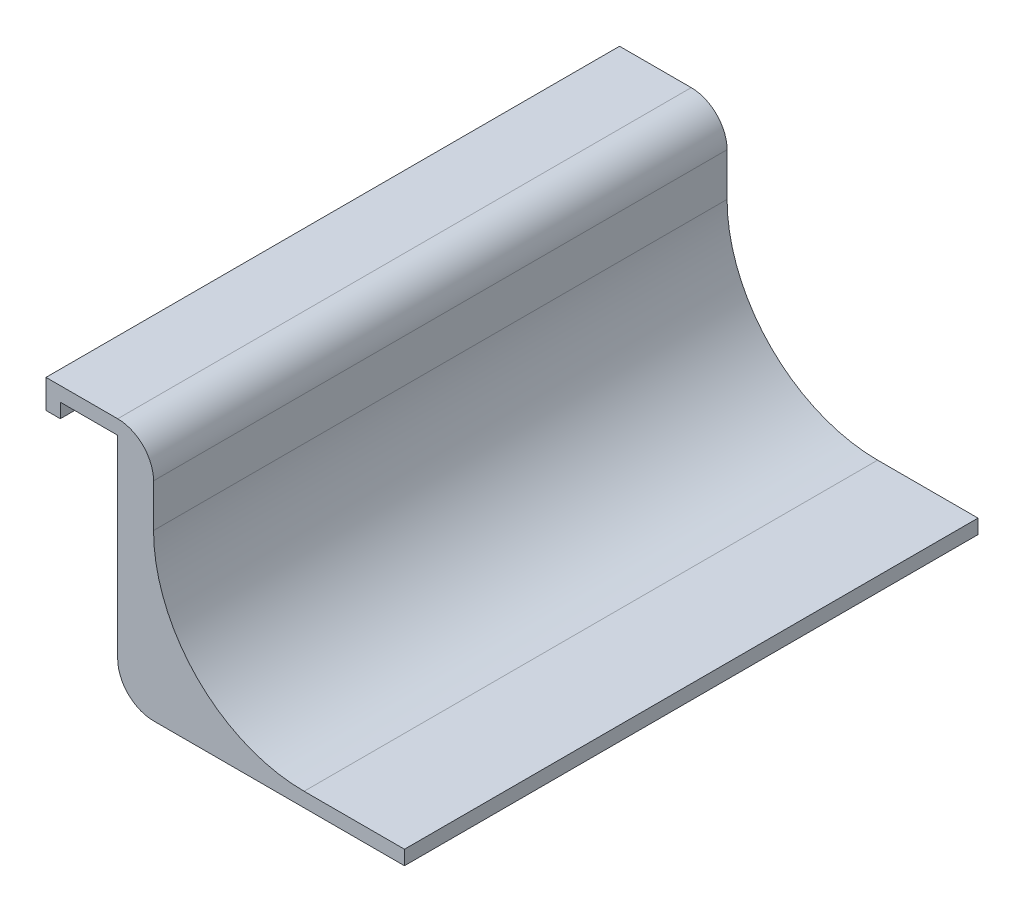
from build123d import *

# Parameters (mm, degrees)
SKETCH1_W           = 40
SKETCH1_H           = 80
BOSS_EXTRUDE4_DEPTH = 2
SKETCH4_W           = 5
SKETCH4_H           = 80
BOSS_EXTRUDE5_DEPTH = 32
FILLET3_R           = 21
SKETCH5_W           = 80
SKETCH5_H           = 2
BOSS_EXTRUDE6_DEPTH = 10
SKETCH6_W           = 2
SKETCH6_H           = 80
BOSS_EXTRUDE7_DEPTH = 2
FILLET4_R           = 5


with BuildPart() as part:
    # Sketch1 → Boss-Extrude4 (new body)
    with BuildSketch(Plane(origin=(0, 0, 0), x_dir=(1, 0, 0), z_dir=(0, 1, 0))):
        Rectangle(SKETCH1_W, SKETCH1_H)
    extrude(amount=BOSS_EXTRUDE4_DEPTH)

    # Sketch4 → Boss-Extrude5 (add)
    with BuildSketch(Plane(origin=(0, 2, 0), x_dir=(1, 0, 0), z_dir=(0, 1, 0))):
        with Locations((-17.5, 0)):
            Rectangle(SKETCH4_W, SKETCH4_H)
    extrude(amount=BOSS_EXTRUDE5_DEPTH)

    # Fillet3
    fillet3_edges = [part.edges().sort_by_distance(p)[0] for p in [
        (-15, 2, 0),
    ]]
    fillet(fillet3_edges, radius=FILLET3_R)

    # Sketch5 → Boss-Extrude6 (add)
    with BuildSketch(Plane.ZY.offset(20)):
        with Locations((0, 33)):
            Rectangle(SKETCH5_W, SKETCH5_H)
    extrude(amount=BOSS_EXTRUDE6_DEPTH)

    # Sketch6 → Boss-Extrude7 (add)
    with BuildSketch(Plane.XZ.offset(-32)):
        with Locations((-29, 0)):
            Rectangle(SKETCH6_W, SKETCH6_H)
    extrude(amount=BOSS_EXTRUDE7_DEPTH)

    # Fillet4
    fillet4_edges = [part.edges().sort_by_distance(p)[0] for p in [
        (-15, 34, 0),
        (-20, 0, 0),
    ]]
    fillet(fillet4_edges, radius=FILLET4_R)


solid = part.part
